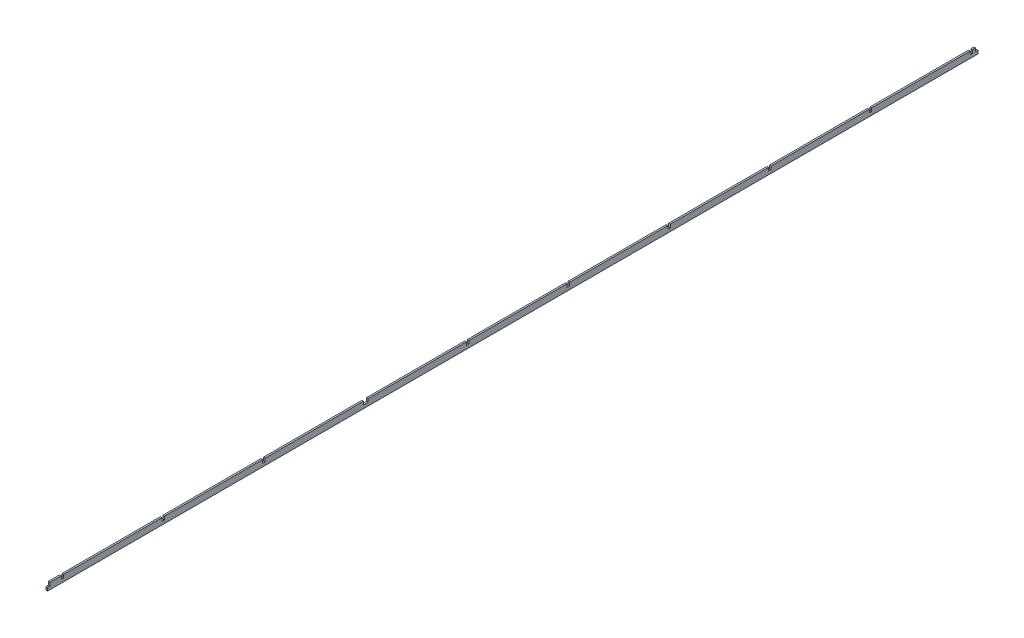
from build123d import *

# Parameters (mm, degrees)
SKETCH_1_W          = 2
SKETCH_1_H          = 8
EXTRUDE_1_DEPTH     = 1155
SKETCH_2_W          = 3
SKETCH_2_H          = 4.040923936
SKETCH_2_H_2        = 4
CUT_EXTRUDE_1_DEPTH = 1044.024193051


with BuildPart() as part:
    # 草图1 → 凸台-拉伸1 (new body)
    with BuildSketch(Plane.XY.offset(-111.99)):
        with Locations((86.037619105, 1.060354741)):
            Rectangle(SKETCH_1_W, SKETCH_1_H)
    extrude(amount=EXTRUDE_1_DEPTH)

    # 草图2 → 切除-拉伸1 (cut, through all)
    with BuildSketch(Plane(origin=(87.037619105, 0, 0), x_dir=(0, 0, -1), z_dir=(1, 0, 0))):
        with Locations((-1041.51, 3.039892773)):
            Rectangle(SKETCH_2_W, SKETCH_2_H)
        with Locations((-1024.51, 3.039892773)):
            Rectangle(SKETCH_2_W, SKETCH_2_H)
        with Locations((-899.51, 3.039892773)):
            Rectangle(SKETCH_2_W, SKETCH_2_H)
        with Locations((-774.51, 3.039892773)):
            Rectangle(SKETCH_2_W, SKETCH_2_H)
        with Locations((-649.51, 3.039892773)):
            Rectangle(SKETCH_2_W, SKETCH_2_H)
        with Locations((-646.51, 3.039892773)):
            Rectangle(SKETCH_2_W, SKETCH_2_H)
        with Locations((-521.51, 3.039892773)):
            Rectangle(SKETCH_2_W, SKETCH_2_H)
        with Locations((-396.51, 3.039892773)):
            Rectangle(SKETCH_2_W, SKETCH_2_H)
        with Locations((-271.51, 3.039892773)):
            Rectangle(SKETCH_2_W, SKETCH_2_H)
        with Locations((-146.51, 3.039892773)):
            Rectangle(SKETCH_2_W, SKETCH_2_H)
        with Locations((-21.51, 3.039892773)):
            Rectangle(SKETCH_2_W, SKETCH_2_H)
        with Locations((103.49, 3.039892773)):
            Rectangle(SKETCH_2_W, SKETCH_2_H)
        with Locations((110.49, 3.060354741)):
            Rectangle(SKETCH_2_W, SKETCH_2_H_2)
    extrude(amount=-CUT_EXTRUDE_1_DEPTH, mode=Mode.SUBTRACT)


solid = part.part
